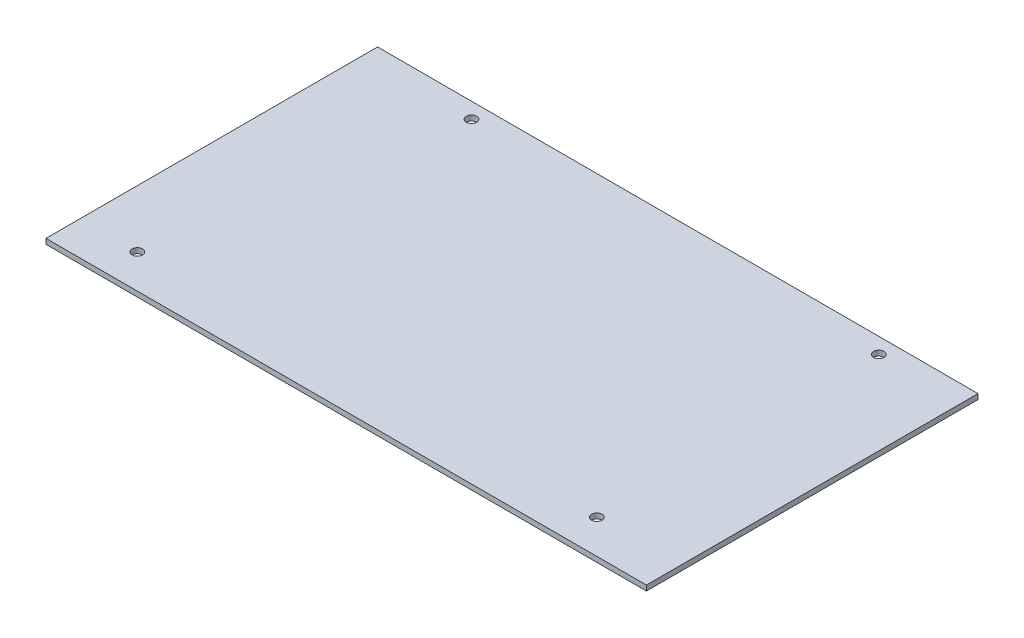
from build123d import *

# Parameters (mm, degrees)
SKETCH1_W           = 115
SKETCH1_H           = 63.5
SKETCH1_R           = 1
BOSS_EXTRUDE1_DEPTH = 1


with BuildPart() as part:
    # Sketch1 → Boss-Extrude1 (new body)
    with BuildSketch(Plane(origin=(0, 0, 0), x_dir=(1, 0, 0), z_dir=(0, 1, 0))):
        Rectangle(SKETCH1_W, SKETCH1_H)
        with Locations(Location((-46.5, -25.25, 0), (0, 0, 270))):
            Circle(SKETCH1_R, mode=Mode.SUBTRACT)
        with Locations(Location((-36.5, 28.75, 0), (0, 0, 270))):
            Circle(SKETCH1_R, mode=Mode.SUBTRACT)
        with Locations(Location((41.5, 28.75, 0), (0, 0, 270))):
            Circle(SKETCH1_R, mode=Mode.SUBTRACT)
        with Locations(Location((41.5, -25.25, 0), (0, 0, 270))):
            Circle(SKETCH1_R, mode=Mode.SUBTRACT)
    extrude(amount=BOSS_EXTRUDE1_DEPTH)


solid = part.part
